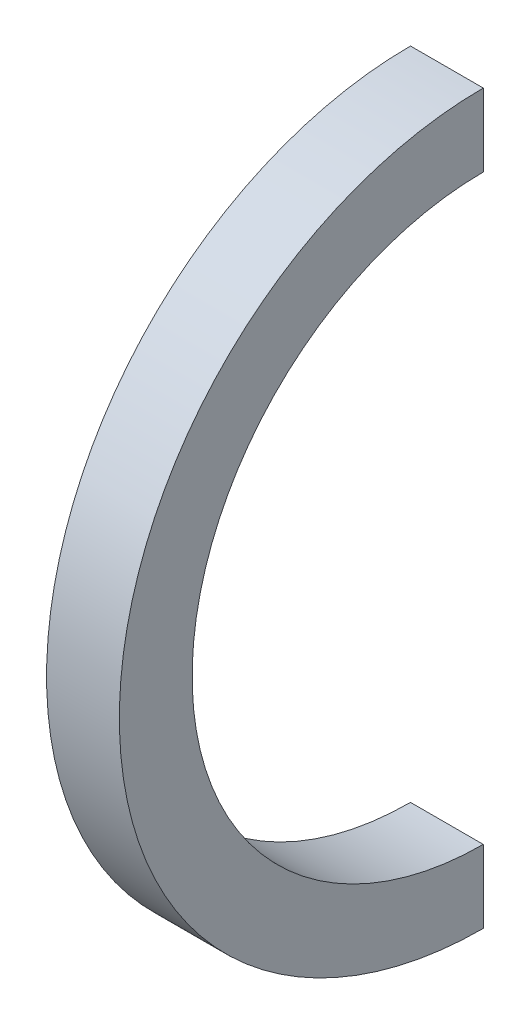
from build123d import *

# Parameters (mm, degrees)
SKETCH1_W      = 25.4
SKETCH1_H      = 25.4
SKETCH1_W_2    = 12.7
SKETCH1_H_2    = 12.7
REVOLVE2_ANGLE = 180


with BuildPart() as part:
    # Sketch1 → Revolve2 (revolve)
    with BuildSketch(Plane.XY):
        with Locations((-12.7, 12.7)):
            Rectangle(SKETCH1_W, SKETCH1_H)
        with Locations((-12.7, 12.7)):
            Rectangle(SKETCH1_W_2, SKETCH1_H_2, mode=Mode.SUBTRACT)
    revolve(axis=Axis((0, 127, 0), (-1, 0, 0)), revolution_arc=REVOLVE2_ANGLE)


solid = part.part
